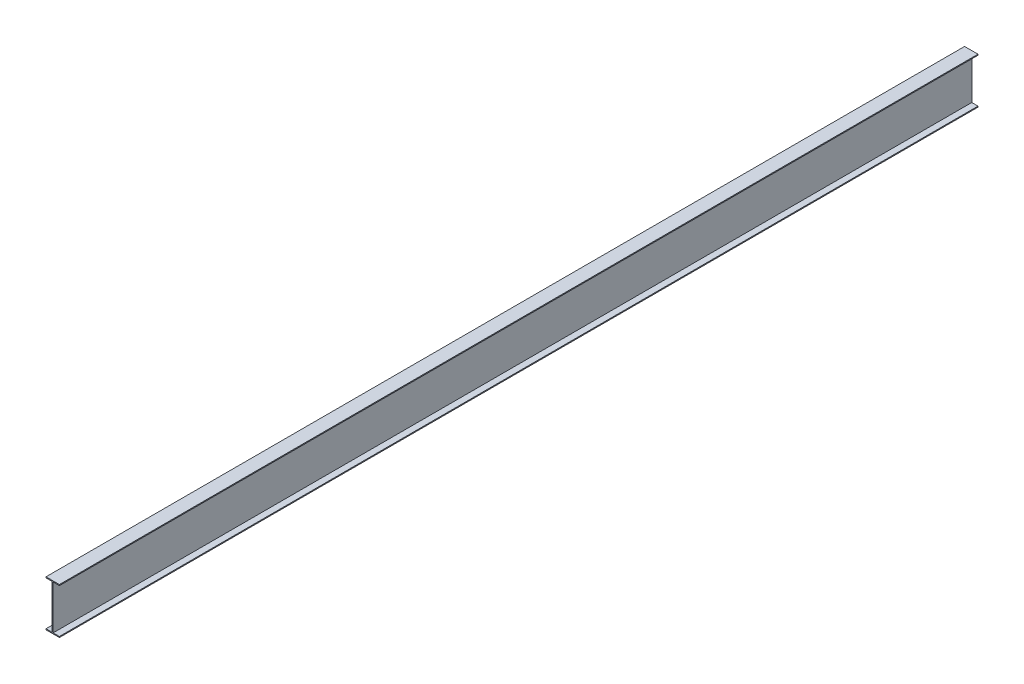
from build123d import *

# Parameters (mm, degrees)
BOSS_EXTRUDE1_DEPTH = 12192


with BuildPart() as part:
    # Sketch1 → Boss-Extrude1 (new body)
    with BuildSketch(Plane.XY):
        Polygon((-6.35, 292.1), (-6.35, -292.1), (-88.9, -292.1), (-88.9, -304.8), (88.9, -304.8), (88.9, -292.1), (6.35, -292.1), (6.35, 292.1), (88.9, 292.1), (88.9, 304.8), (-88.9, 304.8), (-88.9, 292.1), align=None)
    extrude(amount=BOSS_EXTRUDE1_DEPTH)


solid = part.part
